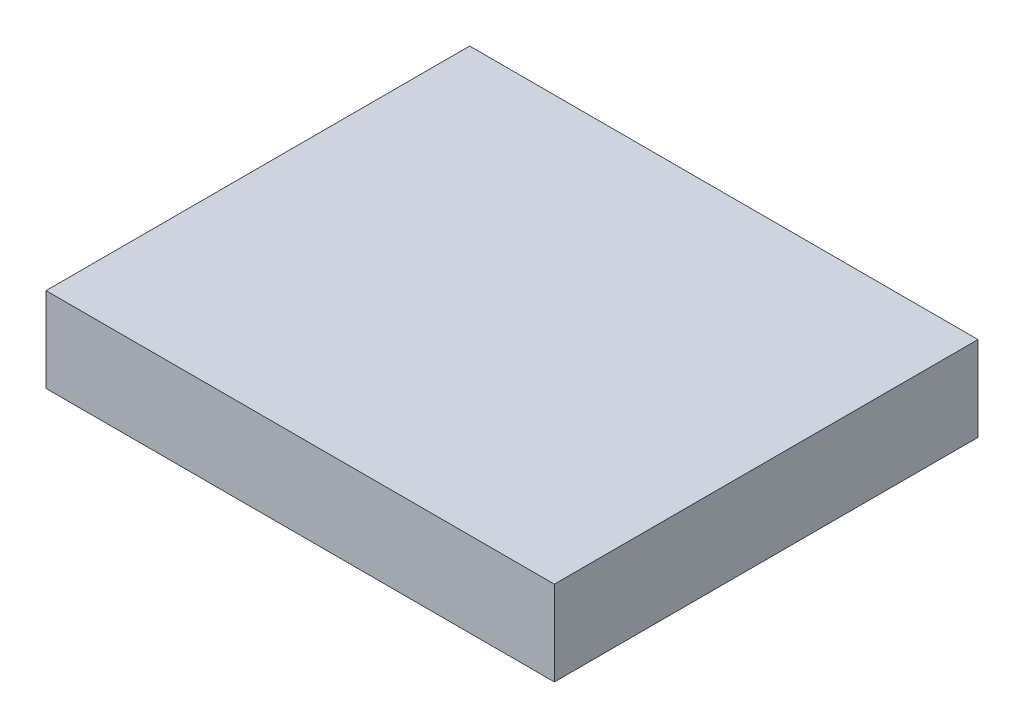
from build123d import *

# Parameters (mm, degrees)
SKETCH1_W           = 76.2
SKETCH1_H           = 63.5
BOSS_EXTRUDE1_DEPTH = 12.7


with BuildPart() as part:
    # Sketch1 → Boss-Extrude1 (new body)
    with BuildSketch(Plane(origin=(0, 0, 0), x_dir=(1, 0, 0), z_dir=(0, 1, 0))):
        with Locations((-53.291162212, 12.009327669)):
            Rectangle(SKETCH1_W, SKETCH1_H)
    extrude(amount=BOSS_EXTRUDE1_DEPTH)


solid = part.part
